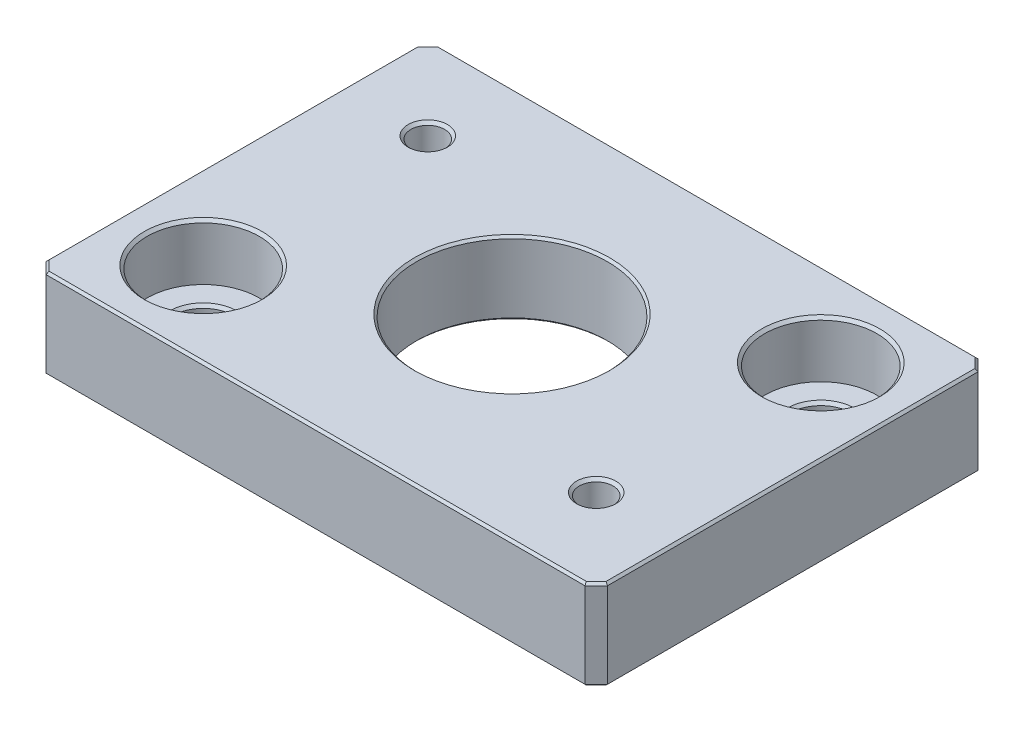
from build123d import *

# Parameters (mm, degrees)
SKETCH1_W                      = 50
SKETCH1_H                      = 35
SKETCH1_R                      = 8.5
BOSS_EXTRUDE1_DEPTH            = 8
F_3_0MM_DOWEL_HOLE1_AT_2_COUNT = 2
F_3_0MM_DOWEL_HOLE1_AT_2_PITCH = 40.311288741
CBORE_FOR_M5_SHCS1_AT_2_COUNT  = 2
CBORE_FOR_M5_SHCS1_AT_2_PITCH  = 40.311288741
SKETCH6_R                      = 11.5
CUT_EXTRUDE1_DEPTH             = 1.5
CHAMFER1_SIZE                  = 1
CHAMFER2_SIZE                  = 0.2


with BuildPart() as part:
    # Sketch1 → Boss-Extrude1 (new body)
    with BuildSketch(Plane(origin=(0, 0, 0), x_dir=(1, 0, 0), z_dir=(0, 1, 0))):
        Rectangle(SKETCH1_W, SKETCH1_H)
        with Locations(Location((0, 0, 0), (0, 0, 270))):
            Circle(SKETCH1_R, mode=Mode.SUBTRACT)
    extrude(amount=BOSS_EXTRUDE1_DEPTH)

    # Sketch3 → Ø3.0mm Dowel Hole1 (revolve, cut)
    with BuildSketch(Plane(origin=(-17.5, 8, -10), x_dir=(0, 0, 1), z_dir=(1, 0, 0))):
        Polygon((0, 0), (0, 8), (1.75, 8), (1.5, 7.75), (1.5, 0.25), (1.75, 0), align=None)
    f_3_0mm_dowel_hole1 = revolve(axis=Axis((-17.5, 14.35, -10), (0, -1, 0)), mode=Mode.SUBTRACT)

    # Ø3.0mm Dowel Hole1 at 2: Ø3.0mm Dowel Hole1 ×2
    with Locations(*[Vector(0.8682431421244593, 0, 0.49613893835683387) * (i * F_3_0MM_DOWEL_HOLE1_AT_2_PITCH) for i in range(1, F_3_0MM_DOWEL_HOLE1_AT_2_COUNT)]):
        add(f_3_0mm_dowel_hole1, mode=Mode.SUBTRACT)

    # Sketch5 → CBORE for M5 SHCS1 (revolve, cut)
    with BuildSketch(Plane(origin=(17.5, 8, -10), x_dir=(0, 0, 1), z_dir=(1, 0, 0))):
        Polygon((0, 0), (0, 8), (3, 8), (2.75, 7.75), (2.75, 5.25), (3, 5), (5, 5), (5, 0.25), (5.25, 0), align=None)
    cbore_for_m5_shcs1 = revolve(axis=Axis((17.5, 14.35, -10), (0, -1, 0)), mode=Mode.SUBTRACT)

    # CBORE for M5 SHCS1 at 2: CBORE for M5 SHCS1 ×2
    with Locations(*[Vector(-0.8682431421244593, 0, 0.49613893835683387) * (i * CBORE_FOR_M5_SHCS1_AT_2_PITCH) for i in range(1, CBORE_FOR_M5_SHCS1_AT_2_COUNT)]):
        add(cbore_for_m5_shcs1, mode=Mode.SUBTRACT)

    # Sketch6 → Cut-Extrude1 (cut)
    with BuildSketch(Plane(origin=(0, 0, 0), x_dir=(1, 0, 0), z_dir=(0, 1, 0))):
        with Locations(Location((0, 0, 0), (0, 0, 270))):
            Circle(SKETCH6_R)
    extrude(amount=CUT_EXTRUDE1_DEPTH, mode=Mode.SUBTRACT)

    # Chamfer1
    chamfer1_edges = [part.edges().sort_by_distance(p)[0] for p in [
        (-25, 4, -17.5),
        (25, 4, -17.5),
        (25, 4, 17.5),
        (-25, 4, 17.5),
    ]]
    chamfer(chamfer1_edges, length=CHAMFER1_SIZE)

    # Chamfer2
    chamfer2_edges = [part.edges().sort_by_distance(p)[0] for p in [
        (0, 8, -8.5),
        (0, 1.5, -8.5),
        (0, 0, -11.5),
        (0, 0, -17.5),
        (0, 8, -17.5),
        (-25, 0, 0),
        (25, 0, 0),
        (0, 0, 17.5),
        (-24.5, 0, 17),
        (-24.5, 0, -17),
        (24.5, 0, 17),
        (24.5, 0, -17),
        (25, 8, 0),
        (-25, 8, 0),
        (0, 8, 17.5),
        (-24.5, 8, 17),
        (-24.5, 8, -17),
        (24.5, 8, 17),
        (24.5, 8, -17),
    ]]
    chamfer(chamfer2_edges, length=CHAMFER2_SIZE)


solid = part.part
